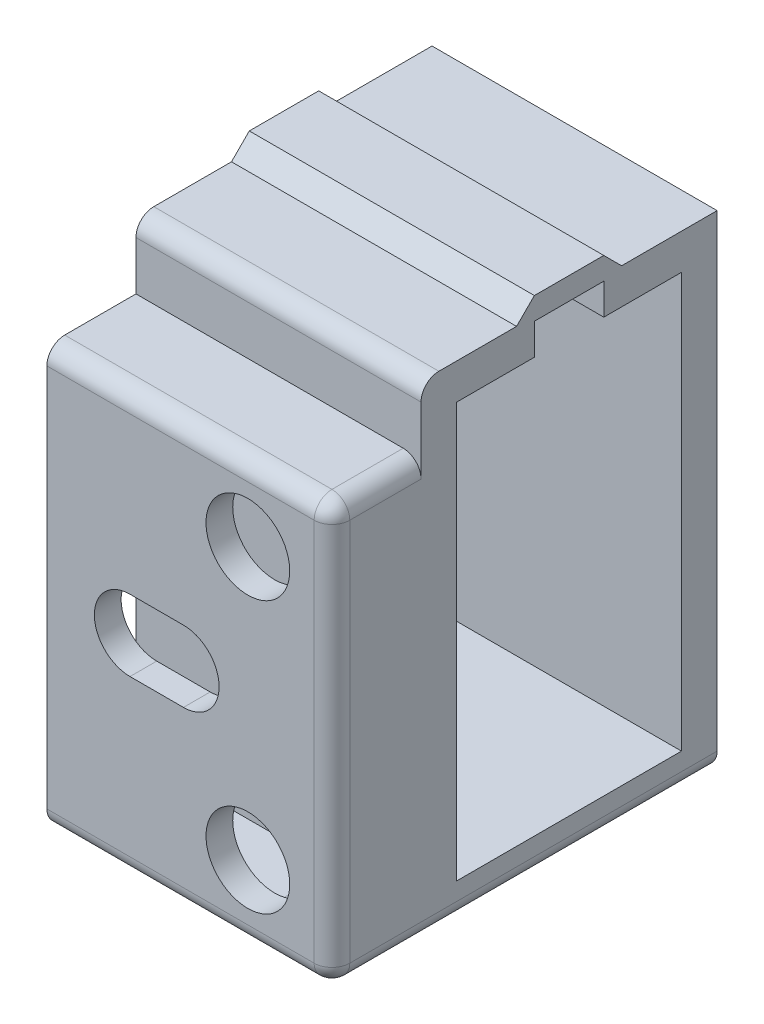
from build123d import *

# Parameters (mm, degrees)
SKETCH1_W                 = 16.6158
SKETCH1_H                 = 27.2711
SKETCH1_W_2               = 12.6158
SKETCH1_H_2               = 23.2711
BOSS_EXTRUDE1_DEPTH       = 8
SKETCH2_W                 = 3.8956
SKETCH2_H                 = 2.5
CUT_EXTRUDE2_DEPTH        = 27.165323553
SKETCH5_W                 = 16
SKETCH5_H                 = 23.53
BOSS_EXTRUDE2_DEPTH       = 0.0001
M2_CLEARANCE_HOLE1_REACH  = 28.452
M2_CLEARANCE_HOLE1_BORE_R = 1.2
BOSS_EXTRUDE3_DEPTH       = 3.5
SKETCH9_W                 = 16
SKETCH9_H                 = 23.53
BOSS_EXTRUDE4_DEPTH       = 1.5
SKETCH10_R                = 2.35
CUT_EXTRUDE3_DEPTH        = 1.5
FILLET1_R                 = 1
BOSS_EXTRUDE5_DEPTH       = 16


with BuildPart() as part:
    # Sketch1 → Boss-Extrude1 (new, symmetric)
    with BuildSketch(Plane(origin=(0, 0, 0), x_dir=(0, 0, -1), z_dir=(1, 0, 0))):
        with Locations((0, -5.32765)):
            Rectangle(SKETCH1_W, SKETCH1_H)
        with Locations((0, -5.32765)):
            Rectangle(SKETCH1_W_2, SKETCH1_H_2, mode=Mode.SUBTRACT)
    extrude(amount=BOSS_EXTRUDE1_DEPTH, both=True)

    # Sketch2 → Cut-Extrude2 (cut, through all)
    with BuildSketch(Plane.ZY.offset(8)):
        with Locations((0, 6.8079)):
            Rectangle(SKETCH2_W, SKETCH2_H)
    extrude(amount=-CUT_EXTRUDE2_DEPTH, mode=Mode.SUBTRACT)

    # Sketch5 → Boss-Extrude2 (add)
    with BuildSketch(Plane.XY.offset(8.3079)):
        with Locations((0, -7.1982)):
            Rectangle(SKETCH5_W, SKETCH5_H)
    extrude(amount=BOSS_EXTRUDE2_DEPTH)

    # M2 Clearance Hole1 bore → M2 Clearance Hole1 (cut, up to next)
    with BuildSketch(Plane.XY.offset(8.308), mode=Mode.PRIVATE) as m2_clearance_hole1_sk1:
        with Locations((3.28, 0.4168)):
            Circle(M2_CLEARANCE_HOLE1_BORE_R)
    m2_clearance_hole1_tool1 = extrude(m2_clearance_hole1_sk1.sketch, amount=-M2_CLEARANCE_HOLE1_REACH, mode=Mode.PRIVATE) & part.part
    # M2 Clearance Hole1 bore → M2 Clearance Hole1 (cut, up to next)
    with BuildSketch(Plane.XY.offset(8.308), mode=Mode.PRIVATE) as m2_clearance_hole1_sk2:
        with Locations((3.28, -14.8132)):
            Circle(M2_CLEARANCE_HOLE1_BORE_R)
    m2_clearance_hole1_tool2 = extrude(m2_clearance_hole1_sk2.sketch, amount=-M2_CLEARANCE_HOLE1_REACH, mode=Mode.PRIVATE) & part.part
    add(m2_clearance_hole1_tool1.solids().sort_by_distance((3.28, 0.4168, 8.308))[0], mode=Mode.SUBTRACT)
    add(m2_clearance_hole1_tool2.solids().sort_by_distance((3.28, -14.8132, 8.308))[0], mode=Mode.SUBTRACT)

    # Sketch8 → Boss-Extrude3 (add)
    with BuildSketch(Plane.XY.offset(8.308)):
        with BuildLine():
            Line((-8, -17.8132), (3.11, -17.8132))
            ThreePointArc((3.11, -17.8132), (5.245462479, -16.928662479), (6.13, -14.7932))
            Line((6.13, -14.7932), (6.13, 0.3968))
            ThreePointArc((6.13, 0.3968), (5.245462479, 2.532262479), (3.11, 3.4168))
            Line((3.11, 3.4168), (-8, 3.4168))
            Line((-8, 3.4168), (-8, 4.5668))
            Line((-8, 4.5668), (8, 4.5668))
            Line((8, 4.5668), (8, -18.9632))
            Line((8, -18.9632), (-8, -18.9632))
            Line((-8, -18.9632), (-8, -17.8132))
        make_face()
    extrude(amount=BOSS_EXTRUDE3_DEPTH)

    # Sketch9 → Boss-Extrude4 (add)
    with BuildSketch(Plane.XY.offset(11.808)):
        with Locations((0, -7.1982)):
            Rectangle(SKETCH9_W, SKETCH9_H)
    extrude(amount=BOSS_EXTRUDE4_DEPTH)

    # Sketch10 → Cut-Extrude3 (cut)
    with BuildSketch(Plane.XY.offset(13.308)):
        with Locations((3.28, 0.4168)):
            Circle(SKETCH10_R)
        with Locations((3.28, -14.8132)):
            Circle(SKETCH10_R)
        with BuildLine():
            Line((-3.335, -5.1982), (-0.335, -5.1982))
            ThreePointArc((-0.335, -5.1982), (1.665, -7.1982), (-0.335, -9.1982))
            Line((-0.335, -9.1982), (-3.335, -9.1982))
            ThreePointArc((-3.335, -9.1982), (-5.335, -7.1982), (-3.335, -5.1982))
        make_face()
    extrude(amount=-CUT_EXTRUDE3_DEPTH, mode=Mode.SUBTRACT)

    # Fillet1
    fillet1_edges = [part.edges().sort_by_distance(p)[0] for p in [
        (8, -7.1982, 13.308),
        (0, 4.5668, 13.308),
        (0, -18.9632, 13.308),
        (8, -18.9632, 2.50005),
        (0, 8.3079, 8.3079),
        (8, 4.5668, 10.80795),
    ]]
    fillet(fillet1_edges, radius=FILLET1_R)

    # Sketch11 → Boss-Extrude5 (add)
    with BuildSketch(Plane.ZY.offset(8)):
        Polygon((2.9478, 8.3079), (1.9478, 9.3079), (-1.9478, 9.3079), (-2.9478, 8.3079), align=None)
    extrude(amount=-BOSS_EXTRUDE5_DEPTH)


solid = part.part
